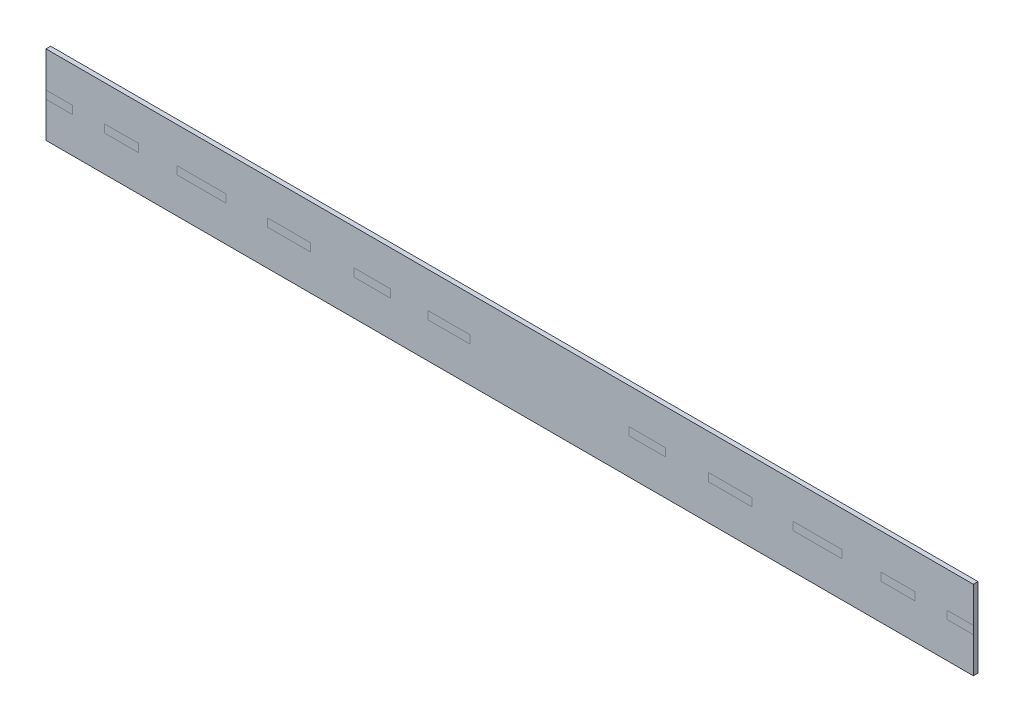
from build123d import *

# Parameters (mm, degrees)
SKETCH1_W           = 2000
SKETCH1_H           = 171
BOSS_EXTRUDE1_DEPTH = 10


with BuildPart() as part:
    # Sketch1 → Boss-Extrude1 (new body)
    with BuildSketch(Plane.XY):
        Rectangle(SKETCH1_W, SKETCH1_H)
    extrude(amount=BOSS_EXTRUDE1_DEPTH)


solid = part.part
